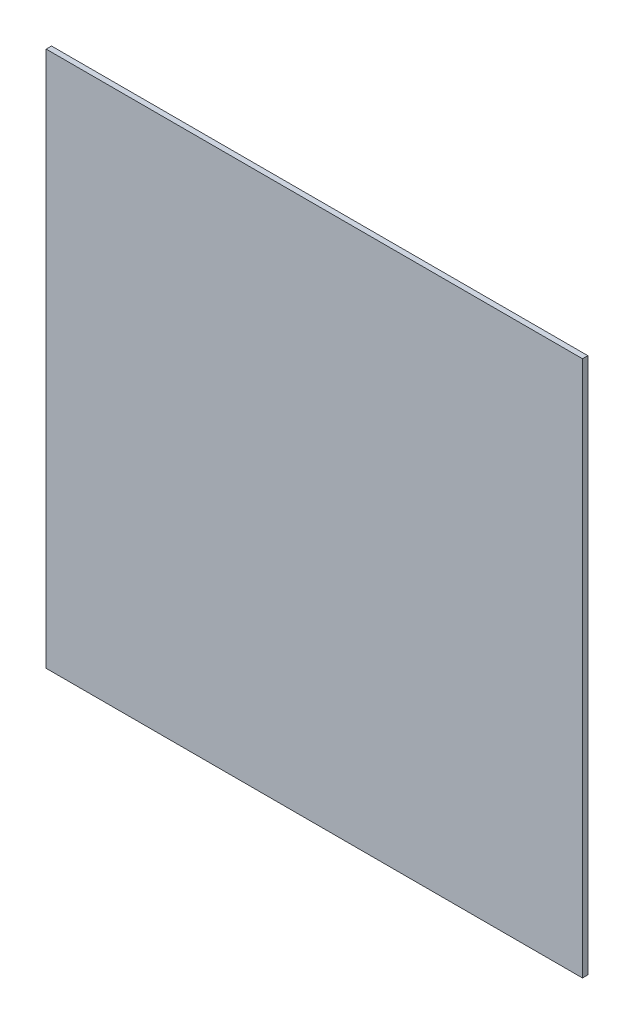
from build123d import *

# Parameters (mm, degrees)
SKETCH_1_W      = 1500
SKETCH_1_H      = 1500
EXTRUDE_1_DEPTH = 15


with BuildPart() as part:
    # 草图1 → 凸台-拉伸1 (new body)
    with BuildSketch(Plane.XY):
        Rectangle(SKETCH_1_W, SKETCH_1_H)
    extrude(amount=EXTRUDE_1_DEPTH)


solid = part.part
